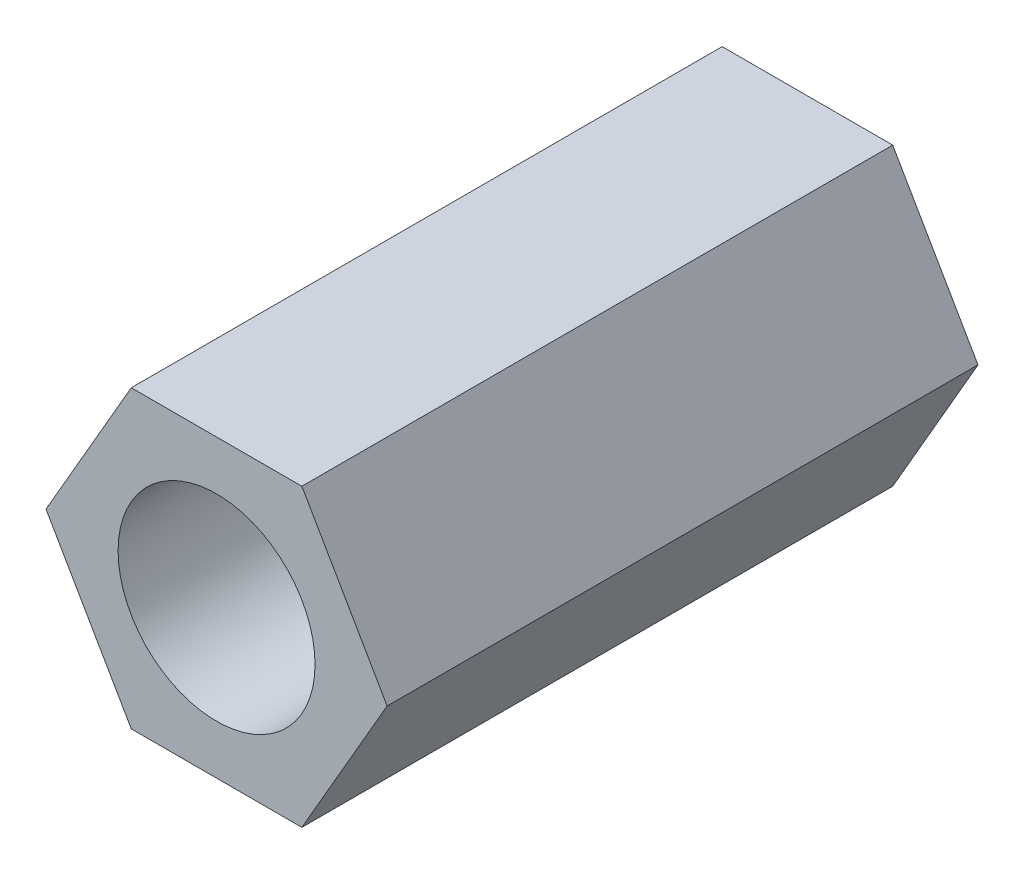
from build123d import *

# Parameters (mm, degrees)
SKETCH_1_R      = 1
EXTRUDE_1_DEPTH = 6


with BuildPart() as part:
    # 草图1 → 凸台-拉伸1 (new body)
    with BuildSketch(Plane.XY):
        Polygon((1.732050808, 0), (0.866025404, 1.5), (-0.866025404, 1.5), (-1.732050808, 0), (-0.866025404, -1.5), (0.866025404, -1.5), align=None)
        Circle(SKETCH_1_R, mode=Mode.SUBTRACT)
    extrude(amount=EXTRUDE_1_DEPTH)


solid = part.part
